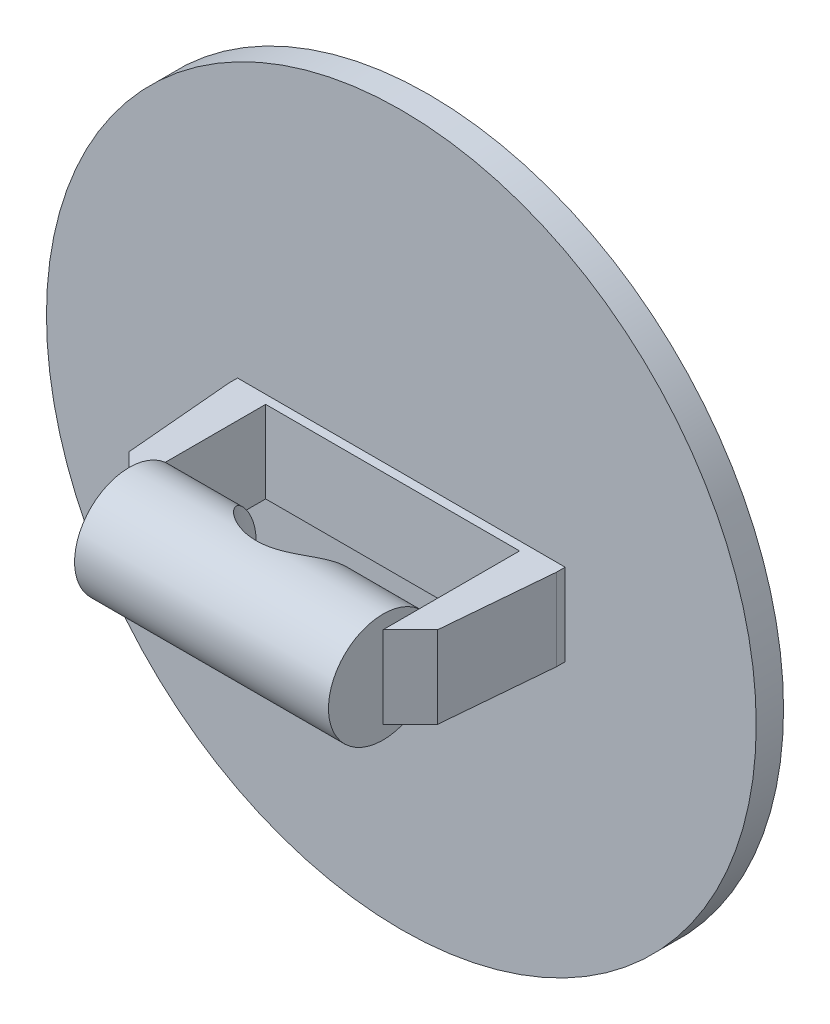
from build123d import *

# Parameters (mm, degrees)
SKETCH1_R               = 10.31875
BOSS_EXTRUDE1_DEPTH     = 0.79375
SKETCH5_W               = 9.525
SKETCH5_H               = 2.38125
BOSS_EXTRUDE2_DEPTH     = 0.254
BOSS_EXTRUDE3_DEPTH     = 2.38125
SKETCH7_R               = 1.5875
BOSS_EXTRUDE4_DEPTH     = 7.381946987
CUT_EXTRUDE1_DEPTH      = 17.513670686
CUT_EXTRUDE1_DEPTH_BACK = 17.513670686
SKETCH8_R               = 1.5875


with BuildPart() as part:
    # Sketch1 → Boss-Extrude1 (new body)
    with BuildSketch(Plane.XY):
        Circle(SKETCH1_R)
    extrude(amount=-BOSS_EXTRUDE1_DEPTH)

    # Sketch4 → Revolve1 (revolve)
    with BuildSketch(Plane(origin=(0, 0, 0), x_dir=(0, 0, -1), z_dir=(1, 0, 0))):
        with BuildLine():
            Line((0.79375, 0), (0.79375, 10.31875))
            ThreePointArc((0.79375, 10.31875), (1.982054014, 5.220075618), (2.38125, 0))
            Line((2.38125, 0), (0.79375, 0))
        make_face()
    revolve(axis=Axis((0, 0, -0.79375), (0, 0, -1)))

    # Sketch5 → Boss-Extrude2 (add)
    with BuildSketch(Plane.XY):
        Rectangle(SKETCH5_W, SKETCH5_H)
    extrude(amount=BOSS_EXTRUDE2_DEPTH)

    # Sketch6 → Boss-Extrude3 (add)
    with BuildSketch(Plane.XZ.offset(1.190625)):
        Polygon((-4.7625, 0.254), (-3.690973493, 0.254), (-3.690973493, 4.22275), (-4.484723493, 3.429), align=None)
        Polygon((4.7625, 0.254), (3.690973493, 0.254), (3.690973493, 4.22275), (4.484723493, 3.429), align=None)
    extrude(amount=-BOSS_EXTRUDE3_DEPTH)

    # Sketch7 → Boss-Extrude4 (add)
    with BuildSketch(Plane(origin=(-3.690973493, 0, 0), x_dir=(0, 0, -1), z_dir=(1, 0, 0))):
        with Locations(Location((-4.22275, 0, 0), (0, 0, 48.590377891))):
            Circle(SKETCH7_R)
    extrude(amount=BOSS_EXTRUDE4_DEPTH)

    # Sketch8 → Cut-Extrude1 (cut, two sides: drawn at the far end of the back side and taken through both)
    with BuildSketch(Plane.XZ.offset(1.190625).offset(-CUT_EXTRUDE1_DEPTH_BACK)):
        with Locations((0, 2.63525)):
            Circle(SKETCH8_R)
    extrude(amount=CUT_EXTRUDE1_DEPTH + CUT_EXTRUDE1_DEPTH_BACK, mode=Mode.SUBTRACT)


solid = part.part
